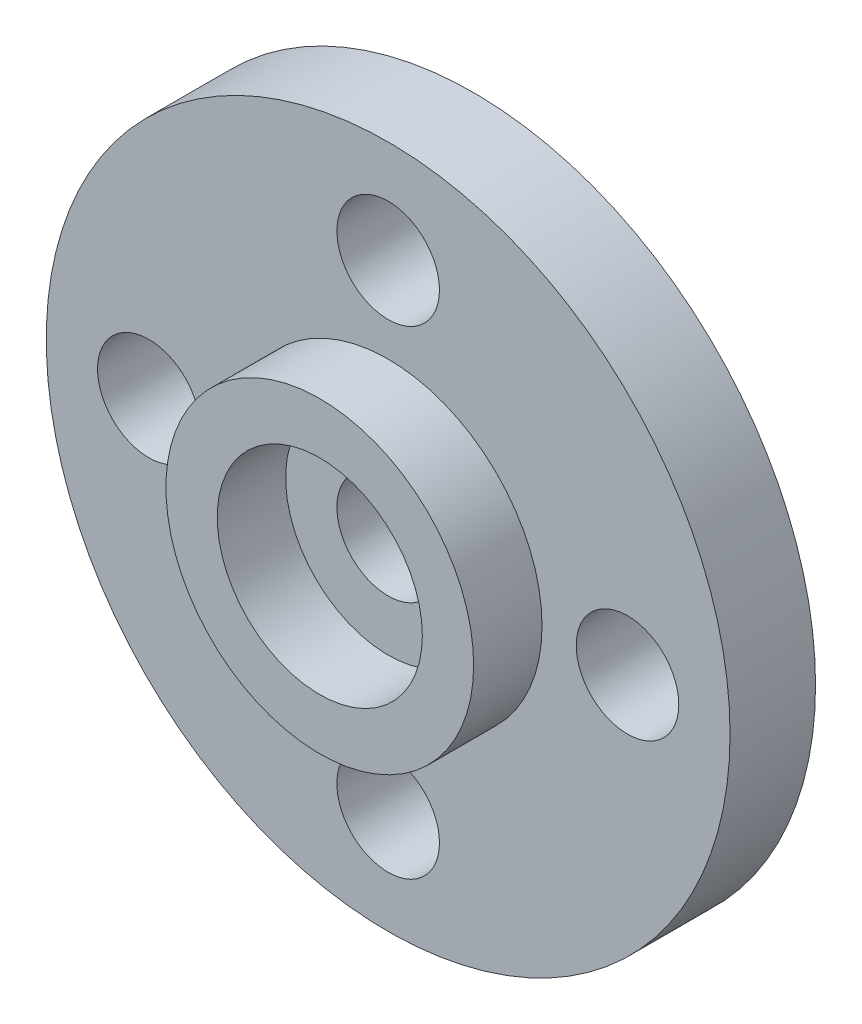
from build123d import *

# Parameters (mm, degrees)
SKETCH_1_R          = 10
SKETCH_1_R_2        = 1.5
EXTRUDE_1_DEPTH     = 2.5
SKETCH_2_R          = 4.5
SKETCH_2_R_2        = 3
EXTRUDE_2_DEPTH     = 2
SKETCH_3_R          = 1.5
CUT_EXTRUDE_1_DEPTH = 3


with BuildPart() as part:
    # 草图1 → 凸台-拉伸1 (new body)
    with BuildSketch(Plane.XY):
        Circle(SKETCH_1_R)
        with Locations((0, 7)):
            Circle(SKETCH_1_R_2, mode=Mode.SUBTRACT)
        with Locations((7, 0)):
            Circle(SKETCH_1_R_2, mode=Mode.SUBTRACT)
        with Locations((0, -7)):
            Circle(SKETCH_1_R_2, mode=Mode.SUBTRACT)
        with Locations((-7, 0)):
            Circle(SKETCH_1_R_2, mode=Mode.SUBTRACT)
    extrude(amount=EXTRUDE_1_DEPTH)

    # 草图2 → 凸台-拉伸2 (add)
    with BuildSketch(Plane.XY.offset(2.5)):
        Circle(SKETCH_2_R)
        Circle(SKETCH_2_R_2, mode=Mode.SUBTRACT)
    extrude(amount=EXTRUDE_2_DEPTH)

    # 草图3 → 切除-拉伸1 (cut)
    with BuildSketch(Plane.XY.offset(2.5)):
        Circle(SKETCH_3_R)
    extrude(amount=-CUT_EXTRUDE_1_DEPTH, mode=Mode.SUBTRACT)


solid = part.part
